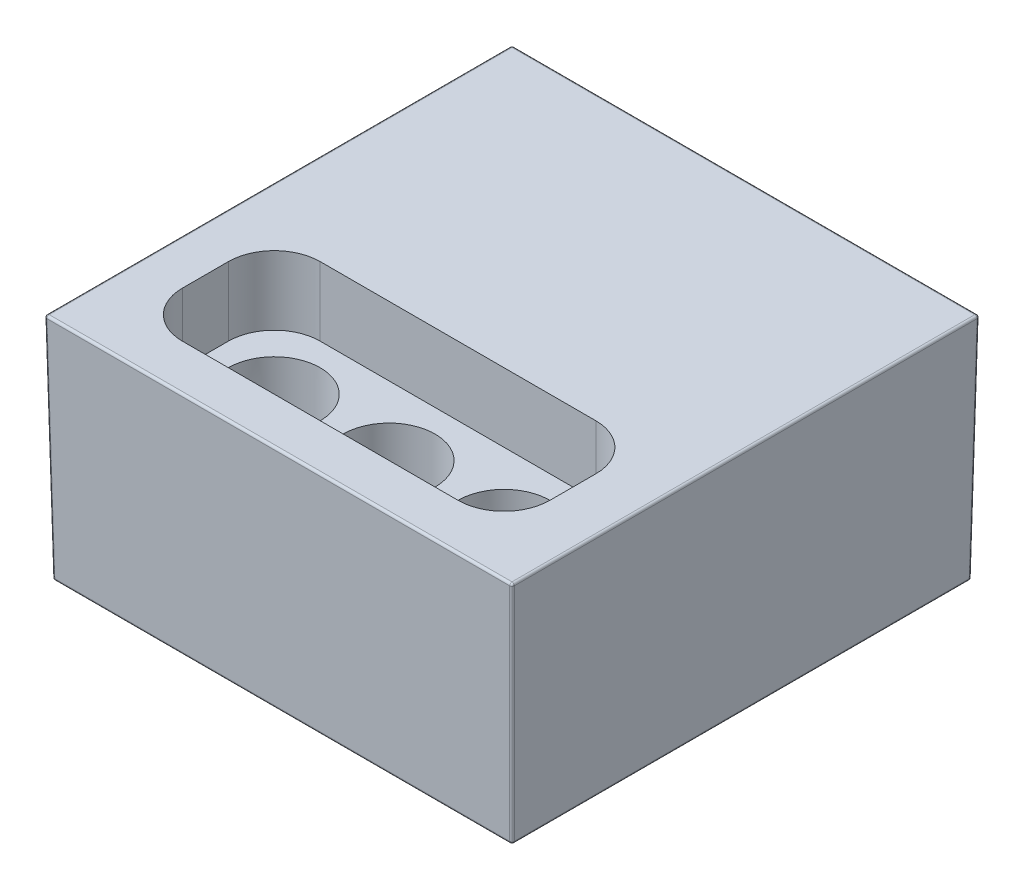
from build123d import *

# Parameters (mm, degrees)
SKETCH1_W                    = 100
SKETCH1_H                    = 100
BOSS_EXTRUDE1_DEPTH          = 50
BOSS_EXTRUDE1_DRAFT          = -1
SKETCH3_W                    = 80
SKETCH3_H                    = 30
CUT_EXTRUDE2_DEPTH           = 15
FILLET1_R                    = 10
SKETCH4_R                    = 10
CUT_EXTRUDE3_DEPTH           = 15
CUT_EXTRUDE3_DRAFT           = -0.5
CUT_EXTRUDE3_PROFILE_2_DEPTH = 15
CUT_EXTRUDE3_PROFILE_2_DRAFT = -0.5
SKETCH5_R                    = 10
CUT_EXTRUDE4_DEPTH           = 30
FILLET2_R                    = 0.5


with BuildPart() as part:
    # Sketch1 → Boss-Extrude1 (with draft: the straight prism first)
    with BuildSketch(Plane(origin=(0, 0, 0), x_dir=(1, 0, 0), z_dir=(0, 1, 0))):
        with Locations((50, 50)):
            Rectangle(SKETCH1_W, SKETCH1_H)
    extrude(amount=BOSS_EXTRUDE1_DEPTH)
    # Boss-Extrude1: the draft: its side faces are tilted about the plane it starts from
    boss_extrude1_sides = [part.faces().sort_by_distance(p)[0] for p in [
        (50, 25, 0),
        (100, 25, -50),
        (50, 25, -100),
        (0, 25, -50),
    ]]
    draft(boss_extrude1_sides, Plane(origin=(0, 0, 0), x_dir=(1, 0, 0), z_dir=(0, 1, 0)), BOSS_EXTRUDE1_DRAFT)

    # Sketch3 → Cut-Extrude2 (cut)
    with BuildSketch(Plane(origin=(0, 50, 0), x_dir=(1, 0, 0), z_dir=(0, 1, 0))):
        with Locations((49.127246754, 24.127246754)):
            Rectangle(SKETCH3_W, SKETCH3_H)
    extrude(amount=-CUT_EXTRUDE2_DEPTH, mode=Mode.SUBTRACT)

    # Fillet1
    fillet1_edges = [part.edges().sort_by_distance(p)[0] for p in [
        (9.127246754, 42.5, -9.127246754),
        (9.127246754, 42.5, -39.127246754),
        (89.127246754, 42.5, -39.127246754),
        (89.127246754, 42.5, -9.127246754),
    ]]
    fillet(fillet1_edges, radius=FILLET1_R)


with BuildPart() as cut_extrude3_tool:
    # Sketch4 → Cut-Extrude3 (with draft: the straight prism first)
    with BuildSketch(Plane(origin=(0, 35, 0), x_dir=(1, 0, 0), z_dir=(0, 1, 0))):
        with Locations((24.127246754, 24.127246754)):
            Circle(SKETCH4_R)
    extrude(amount=-CUT_EXTRUDE3_DEPTH)
    # Cut-Extrude3: the draft: its side faces are tilted about the plane it starts from
    cut_extrude3_sides = [cut_extrude3_tool.faces().sort_by_distance(p)[0] for p in [
        (14.127246754, 27.5, -24.127246754),
    ]]
    draft(cut_extrude3_sides, Plane(origin=(0, 35, 0), x_dir=(1, 0, 0), z_dir=(0, 1, 0)), CUT_EXTRUDE3_DRAFT)


with BuildPart() as part_1:
    add(part.part)

    # Cut-Extrude3: cut by cut_extrude3_tool
    add(cut_extrude3_tool.part, mode=Mode.SUBTRACT)


with BuildPart() as cut_extrude3_profile_2_tool:
    # Sketch4 → Cut-Extrude3 profile 2 (with draft: the straight prism first)
    with BuildSketch(Plane(origin=(0, 35, 0), x_dir=(1, 0, 0), z_dir=(0, 1, 0))):
        with Locations((74.127246754, 24.127246754)):
            Circle(SKETCH4_R)
    extrude(amount=-CUT_EXTRUDE3_PROFILE_2_DEPTH)
    # Cut-Extrude3 profile 2: the draft: its side faces are tilted about the plane it starts from
    cut_extrude3_profile_2_sides = [cut_extrude3_profile_2_tool.faces().sort_by_distance(p)[0] for p in [
        (64.127246754, 27.5, -24.127246754),
    ]]
    draft(cut_extrude3_profile_2_sides, Plane(origin=(0, 35, 0), x_dir=(1, 0, 0), z_dir=(0, 1, 0)), CUT_EXTRUDE3_PROFILE_2_DRAFT)


with BuildPart() as part_2:
    add(part_1.part)

    # Cut-Extrude3 profile 2: cut by cut_extrude3_profile_2_tool
    add(cut_extrude3_profile_2_tool.part, mode=Mode.SUBTRACT)

    # Sketch5 → Cut-Extrude4 (cut)
    with BuildSketch(Plane(origin=(0, 35, 0), x_dir=(1, 0, 0), z_dir=(0, 1, 0))):
        with Locations(Location((49.127246754, 24.127246754, 0), (0, 0, 270))):
            Circle(SKETCH5_R)
    extrude(amount=-CUT_EXTRUDE4_DEPTH, mode=Mode.SUBTRACT)

    # Fillet2
    fillet2_edges = [part_2.edges().sort_by_distance(p)[0] for p in [
        (100.872753246, 50, -50),
        (50, 50, -100.872753246),
        (-0.872753246, 50, -50),
        (50, 0, -100),
        (100, 0, -50),
        (50, 0, 0),
        (0, 0, -50),
        (50, 50, 0.872753246),
        (-0.436376623, 25, -100.436376623),
        (100.436376623, 25, -100.436376623),
        (100.436376623, 25, 0.436376623),
        (-0.436376623, 25, 0.436376623),
    ]]
    fillet(fillet2_edges, radius=FILLET2_R)


solid = part_2.part
